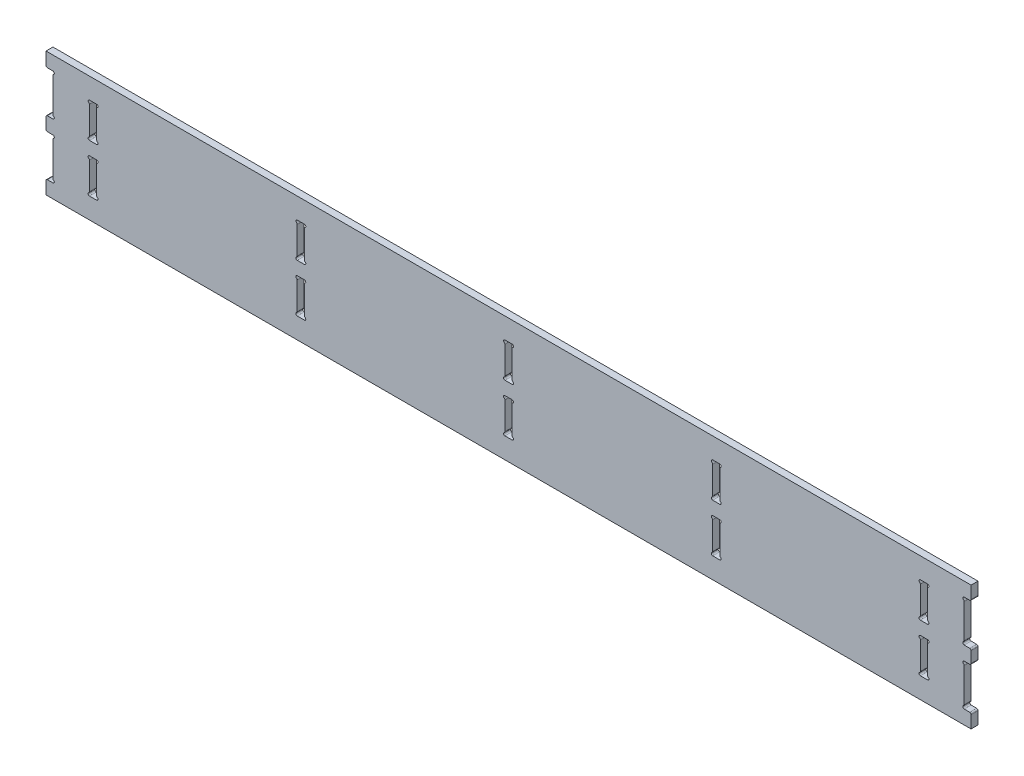
from build123d import *

# Parameters (mm, degrees)
SKETCH2_W           = 668
SKETCH2_H           = 90
BOSS_EXTRUDE1_DEPTH = 5
SKETCH4_W           = 5.2
SKETCH4_H           = 25.2
CUT_EXTRUDE2_DEPTH  = 346.949418268
SKETCH5_R           = 1
CUT_EXTRUDE3_DEPTH  = 346.949418268
FILLET1_R           = 1
SKETCH6_W           = 5
SKETCH6_H           = 30
CUT_EXTRUDE4_DEPTH  = 5
SKETCH7_R           = 1
CUT_EXTRUDE5_DEPTH  = 346.949418268
FILLET2_R           = 1


with BuildPart() as part:
    # Sketch2 → Boss-Extrude1 (new body)
    with BuildSketch(Plane.XY):
        with Locations((0, 45)):
            Rectangle(SKETCH2_W, SKETCH2_H)
    extrude(amount=BOSS_EXTRUDE1_DEPTH)

    # Sketch4 → Cut-Extrude2 (cut, through all)
    with BuildSketch(Plane(origin=(0, 0, 0), x_dir=(-1, 0, 0), z_dir=(0, 0, -1))):
        with Locations((0, 62.4)):
            Rectangle(SKETCH4_W, SKETCH4_H)
        with Locations((0, 27.6)):
            Rectangle(SKETCH4_W, SKETCH4_H)
        with Locations((150, 62.4)):
            Rectangle(SKETCH4_W, SKETCH4_H)
        with Locations((150, 27.6)):
            Rectangle(SKETCH4_W, SKETCH4_H)
        with Locations((300, 62.4)):
            Rectangle(SKETCH4_W, SKETCH4_H)
        with Locations((300, 27.6)):
            Rectangle(SKETCH4_W, SKETCH4_H)
        with Locations((-300, 27.6)):
            Rectangle(SKETCH4_W, SKETCH4_H)
        with Locations((-300, 62.4)):
            Rectangle(SKETCH4_W, SKETCH4_H)
        with Locations((-150, 27.6)):
            Rectangle(SKETCH4_W, SKETCH4_H)
        with Locations((-150, 62.4)):
            Rectangle(SKETCH4_W, SKETCH4_H)
    extrude(amount=-CUT_EXTRUDE2_DEPTH, mode=Mode.SUBTRACT)

    # Sketch5 → Cut-Extrude3 (cut, through all)
    with BuildSketch(Plane(origin=(0, 0, 0), x_dir=(-1, 0, 0), z_dir=(0, 0, -1))):
        with Locations((-302.6, 74)):
            Circle(SKETCH5_R)
        with Locations((-297.4, 74)):
            Circle(SKETCH5_R)
        with Locations((-302.6, 50.8)):
            Circle(SKETCH5_R)
        with Locations((-297.4, 50.8)):
            Circle(SKETCH5_R)
        with Locations((-302.6, 39.2)):
            Circle(SKETCH5_R)
        with Locations((-297.4, 39.2)):
            Circle(SKETCH5_R)
        with Locations((-302.6, 16)):
            Circle(SKETCH5_R)
        with Locations((-297.4, 16)):
            Circle(SKETCH5_R)
        with Locations((-152.6, 74)):
            Circle(SKETCH5_R)
        with Locations((-147.4, 74)):
            Circle(SKETCH5_R)
        with Locations((-152.6, 50.8)):
            Circle(SKETCH5_R)
        with Locations((-147.4, 50.8)):
            Circle(SKETCH5_R)
        with Locations((-152.6, 39.2)):
            Circle(SKETCH5_R)
        with Locations((-147.4, 39.2)):
            Circle(SKETCH5_R)
        with Locations((-152.6, 16)):
            Circle(SKETCH5_R)
        with Locations((-147.4, 16)):
            Circle(SKETCH5_R)
        with Locations((-2.6, 74)):
            Circle(SKETCH5_R)
        with Locations((2.6, 74)):
            Circle(SKETCH5_R)
        with Locations((-2.6, 50.8)):
            Circle(SKETCH5_R)
        with Locations((2.6, 50.8)):
            Circle(SKETCH5_R)
        with Locations((-2.6, 39.2)):
            Circle(SKETCH5_R)
        with Locations((2.6, 39.2)):
            Circle(SKETCH5_R)
        with Locations((-2.6, 16)):
            Circle(SKETCH5_R)
        with Locations((2.6, 16)):
            Circle(SKETCH5_R)
        with Locations((147.4, 74)):
            Circle(SKETCH5_R)
        with Locations((152.6, 74)):
            Circle(SKETCH5_R)
        with Locations((147.4, 50.8)):
            Circle(SKETCH5_R)
        with Locations((152.6, 50.8)):
            Circle(SKETCH5_R)
        with Locations((147.4, 39.2)):
            Circle(SKETCH5_R)
        with Locations((152.6, 39.2)):
            Circle(SKETCH5_R)
        with Locations((147.4, 16)):
            Circle(SKETCH5_R)
        with Locations((152.6, 16)):
            Circle(SKETCH5_R)
        with Locations((297.4, 74)):
            Circle(SKETCH5_R)
        with Locations((302.6, 74)):
            Circle(SKETCH5_R)
        with Locations((297.4, 50.8)):
            Circle(SKETCH5_R)
        with Locations((302.6, 50.8)):
            Circle(SKETCH5_R)
        with Locations((297.4, 39.2)):
            Circle(SKETCH5_R)
        with Locations((302.6, 39.2)):
            Circle(SKETCH5_R)
        with Locations((297.4, 16)):
            Circle(SKETCH5_R)
        with Locations((302.6, 16)):
            Circle(SKETCH5_R)
    extrude(amount=-CUT_EXTRUDE3_DEPTH, mode=Mode.SUBTRACT)

    # Fillet1
    fillet1_edges = [part.edges().sort_by_distance(p)[0] for p in [
        (152.6, 38.2, 2.5),
        (152.6, 17, 2.5),
        (147.4, 38.2, 2.5),
        (302.6, 73, 2.5),
        (302.6, 51.8, 2.5),
        (297.4, 73, 2.5),
        (-302.6, 38.2, 2.5),
        (-302.6, 73, 2.5),
        (-152.6, 38.2, 2.5),
        (-152.6, 73, 2.5),
        (302.6, 38.2, 2.5),
        (302.6, 17, 2.5),
        (297.4, 38.2, 2.5),
        (-2.6, 38.2, 2.5),
        (152.6, 51.8, 2.5),
        (152.6, 73, 2.5),
        (147.4, 73, 2.5),
        (-2.6, 73, 2.5),
        (2.6, 17, 2.5),
        (-2.6, 17, 2.5),
        (-147.4, 73, 2.5),
        (2.6, 51.8, 2.5),
        (-2.6, 51.8, 2.5),
        (2.6, 38.2, 2.5),
        (-147.4, 17, 2.5),
        (-152.6, 17, 2.5),
        (-297.4, 73, 2.5),
        (-147.4, 51.8, 2.5),
        (-152.6, 51.8, 2.5),
        (-147.4, 38.2, 2.5),
        (297.4, 17, 2.5),
        (297.4, 51.8, 2.5),
        (147.4, 17, 2.5),
        (2.6, 73, 2.5),
        (147.4, 51.8, 2.5),
        (-297.4, 17, 2.5),
        (-302.6, 17, 2.5),
        (-297.4, 51.8, 2.5),
        (-302.6, 51.8, 2.5),
        (-297.4, 38.2, 2.5),
    ]]
    fillet(fillet1_edges, radius=FILLET1_R)

    # Sketch6 → Cut-Extrude4 (cut)
    with BuildSketch(Plane(origin=(334, 0, 0), x_dir=(0, 0, -1), z_dir=(1, 0, 0))):
        with Locations((-2.5, 65)):
            Rectangle(SKETCH6_W, SKETCH6_H)
        with Locations((-2.5, 25)):
            Rectangle(SKETCH6_W, SKETCH6_H)
    cut_extrude4 = extrude(amount=-CUT_EXTRUDE4_DEPTH, mode=Mode.SUBTRACT)

    # Mirror1: Cut-Extrude4 across plane
    add(cut_extrude4.mirror(Plane(origin=(0, 0, 0), x_dir=(0, 0, 1), z_dir=(1, 0, 0))), mode=Mode.SUBTRACT)

    # Sketch7 → Cut-Extrude5 (cut, through all)
    with BuildSketch(Plane(origin=(0, 0, 0), x_dir=(-1, 0, 0), z_dir=(0, 0, -1))):
        with Locations((-329, 79)):
            Circle(SKETCH7_R)
        with Locations((-329, 51)):
            Circle(SKETCH7_R)
        with Locations((-329, 39)):
            Circle(SKETCH7_R)
        with Locations((-329, 11)):
            Circle(SKETCH7_R)
        with Locations((329, 11)):
            Circle(SKETCH7_R)
        with Locations((329, 39)):
            Circle(SKETCH7_R)
        with Locations((329, 51)):
            Circle(SKETCH7_R)
        with Locations((329, 79)):
            Circle(SKETCH7_R)
    extrude(amount=-CUT_EXTRUDE5_DEPTH, mode=Mode.SUBTRACT)

    # Fillet2
    fillet2_edges = [part.edges().sort_by_distance(p)[0] for p in [
        (334, 50, 2.5),
        (334, 80, 2.5),
        (334, 40, 2.5),
        (334, 10, 2.5),
        (-334, 50, 2.5),
        (-334, 80, 2.5),
        (-334, 40, 2.5),
        (-334, 10, 2.5),
        (-329, 78, 2.5),
        (-329, 52, 2.5),
        (-329, 38, 2.5),
        (-329, 12, 2.5),
        (329, 78, 2.5),
        (329, 52, 2.5),
        (329, 12, 2.5),
        (329, 38, 2.5),
    ]]
    fillet(fillet2_edges, radius=FILLET2_R)


solid = part.part
